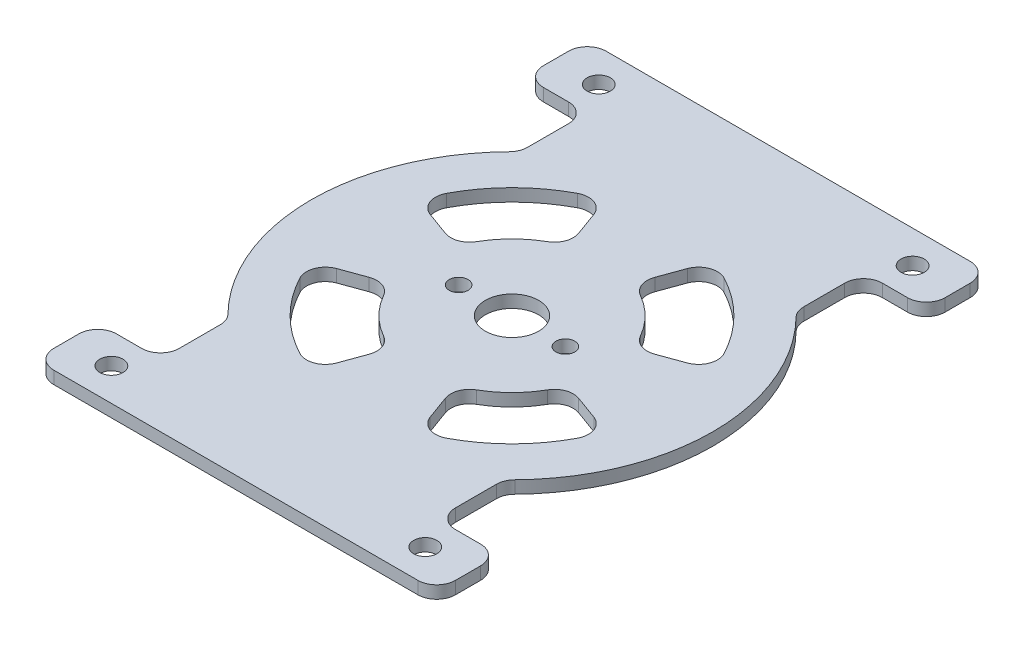
from build123d import *

# Parameters (mm, degrees)
SKETCH1_R           = 4.25
BOSS_EXTRUDE1_DEPTH = 2
CUT_EXTRUDE1_DEPTH  = 5
CIRPATTERN1_COUNT   = 4
SKETCH3_R           = 1.5
CUT_EXTRUDE2_DEPTH  = 5
SKETCH5_R           = 1.85
CUT_EXTRUDE3_DEPTH  = 5
FILLET1_R           = 3


with BuildPart() as part:
    # Sketch1 → Boss-Extrude1 (new body)
    with BuildSketch(Plane(origin=(0, 0, 0), x_dir=(1, 0, 0), z_dir=(0, 1, 0))):
        with BuildLine():
            Line((-29, -34), (-25, -34))
            ThreePointArc((-25, -34), (-22.878679656, -33.121320344), (-22, -31))
            Line((-22, -31), (-22, -24.494897428))
            ThreePointArc((-22, -24.494897428), (-22.222539701, -23.361004009), (-22.857142857, -22.395334791))
            ThreePointArc((-22.857142857, -22.395334791), (-32, 0), (-22.857142857, 22.395334791))
            ThreePointArc((-22.857142857, 22.395334791), (-22.222539701, 23.361004009), (-22, 24.494897428))
            Line((-22, 24.494897428), (-22, 31))
            ThreePointArc((-22, 31), (-22.878679656, 33.121320344), (-25, 34))
            Line((-25, 34), (-29, 34))
            ThreePointArc((-29, 34), (-31.121320344, 34.878679656), (-32, 37))
            Line((-32, 37), (-32, 44))
            Line((-32, 44), (32, 44))
            Line((32, 44), (32, 37))
            ThreePointArc((32, 37), (31.121320344, 34.878679656), (29, 34))
            Line((29, 34), (25, 34))
            ThreePointArc((25, 34), (22.878679656, 33.121320344), (22, 31))
            Line((22, 31), (22, 24.494897428))
            ThreePointArc((22, 24.494897428), (22.222539701, 23.361004009), (22.857142857, 22.395334791))
            ThreePointArc((22.857142857, 22.395334791), (32, 0), (22.857142857, -22.395334791))
            ThreePointArc((22.857142857, -22.395334791), (22.222539701, -23.361004009), (22, -24.494897428))
            Line((22, -24.494897428), (22, -31))
            ThreePointArc((22, -31), (22.878679656, -33.121320344), (25, -34))
            Line((25, -34), (29, -34))
            ThreePointArc((29, -34), (31.121320344, -34.878679656), (32, -37))
            Line((32, -37), (32, -44))
            Line((32, -44), (-32, -44))
            Line((-32, -44), (-32, -37))
            ThreePointArc((-32, -37), (-31.121320344, -34.878679656), (-29, -34))
        make_face()
        with Locations(Location((0, 0, 0), (0, 0, 270))):
            Circle(SKETCH1_R, mode=Mode.SUBTRACT)
    extrude(amount=BOSS_EXTRUDE1_DEPTH)

    # Sketch2 → Cut-Extrude1 (cut)
    with BuildSketch(Plane(origin=(0, 2, 0), x_dir=(1, 0, 0), z_dir=(0, 1, 0))):
        with BuildLine():
            ThreePointArc((-11.674129624, 22.106892534), (-9.194159134, 22.25327912), (-7.454156207, 20.48012586))
            Line((-7.454156207, 20.48012586), (-6.070255366, 16.677889548))
            ThreePointArc((-6.070255366, 16.677889548), (-6.073907786, 14.615788781), (-7.40777769, 13.043190932))
            ThreePointArc((-7.40777769, 13.043190932), (-10.606601718, 10.606601718), (-13.043190932, 7.40777769))
            ThreePointArc((-13.043190932, 7.40777769), (-14.615788781, 6.073907786), (-16.677889548, 6.070255366))
            Line((-16.677889548, 6.070255366), (-20.48012586, 7.454156207))
            ThreePointArc((-20.48012586, 7.454156207), (-22.25327912, 9.194159134), (-22.106892534, 11.674129624))
            ThreePointArc((-22.106892534, 11.674129624), (-17.67766953, 17.67766953), (-11.674129624, 22.106892534))
        make_face()
    cut_extrude1 = extrude(amount=-CUT_EXTRUDE1_DEPTH, mode=Mode.SUBTRACT)

    # CirPattern1: Cut-Extrude1 ×4 about axis
    cirpattern1_axis = Axis((0, 0, 0), (0, 1, 0))
    for i in range(1, CIRPATTERN1_COUNT):
        add(cut_extrude1.rotate(cirpattern1_axis, i * 360 / CIRPATTERN1_COUNT), mode=Mode.SUBTRACT)

    # Sketch3 → Cut-Extrude2 (cut)
    with BuildSketch(Plane(origin=(0, 2, 0), x_dir=(1, 0, 0), z_dir=(0, 1, 0))):
        with Locations(Location((-8.5, 0, 0), (0, 0, 270))):
            Circle(SKETCH3_R)
        with Locations(Location((8.5, 0, 0), (0, 0, 270))):
            Circle(SKETCH3_R)
    extrude(amount=-CUT_EXTRUDE2_DEPTH, mode=Mode.SUBTRACT)

    # Sketch5 → Cut-Extrude3 (cut)
    with BuildSketch(Plane(origin=(0, 2, 0), x_dir=(1, 0, 0), z_dir=(0, 1, 0))):
        with Locations(Location((25, 38.82, 0), (0, 0, 270))):
            Circle(SKETCH5_R)
        with Locations(Location((-25, 38.82, 0), (0, 0, 270))):
            Circle(SKETCH5_R)
        with Locations(Location((-25, -38.82, 0), (0, 0, 270))):
            Circle(SKETCH5_R)
        with Locations(Location((25, -38.82, 0), (0, 0, 270))):
            Circle(SKETCH5_R)
    extrude(amount=-CUT_EXTRUDE3_DEPTH, mode=Mode.SUBTRACT)

    # Fillet1
    fillet1_edges = [part.edges().sort_by_distance(p)[0] for p in [
        (-32, 1, -44),
        (32, 1, -44),
        (32, 1, 44),
        (-32, 1, 44),
    ]]
    fillet(fillet1_edges, radius=FILLET1_R)


solid = part.part
